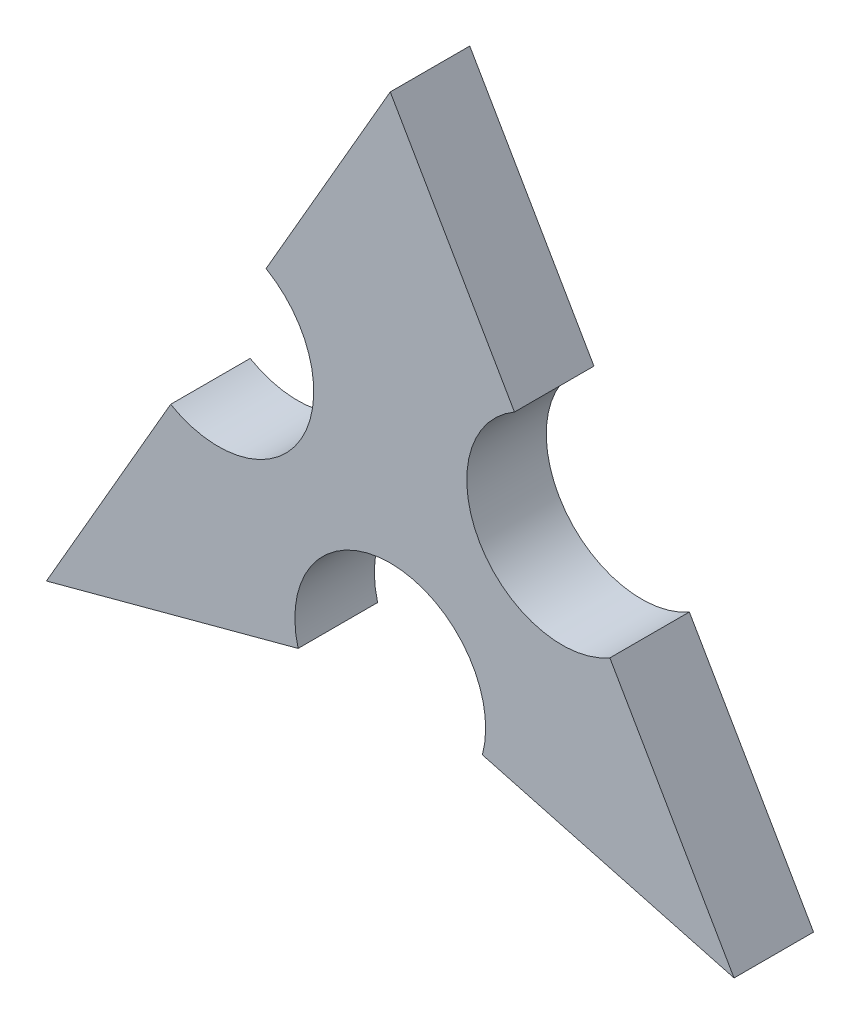
from build123d import *

# Parameters (mm, degrees)
BOSS_EXTRUDE1_DEPTH = 10


with BuildPart() as part:
    # Sketch1 → Boss-Extrude1 (new, symmetric)
    with BuildSketch(Plane.XY):
        with BuildLine():
            Line((0, 149.822394855), (31.25, 95.695807118))
            ThreePointArc((31.25, 95.695807118), (22.465390309, 62.911197427), (55.25, 54.126587737))
            Line((55.25, 54.126587737), (86.5, 0))
            Line((86.5, 0), (23.182219831, 16.965948063))
            ThreePointArc((23.182219831, 16.965948063), (0, 47.177605145), (-23.182219831, 16.965948063))
            Line((-23.182219831, 16.965948063), (-86.5, 0))
            Line((-86.5, 0), (-55.25, 54.126587737))
            ThreePointArc((-55.25, 54.126587737), (-22.465390309, 62.911197427), (-31.25, 95.695807118))
            Line((-31.25, 95.695807118), (0, 149.822394855))
        make_face()
    extrude(amount=BOSS_EXTRUDE1_DEPTH, both=True)


solid = part.part
